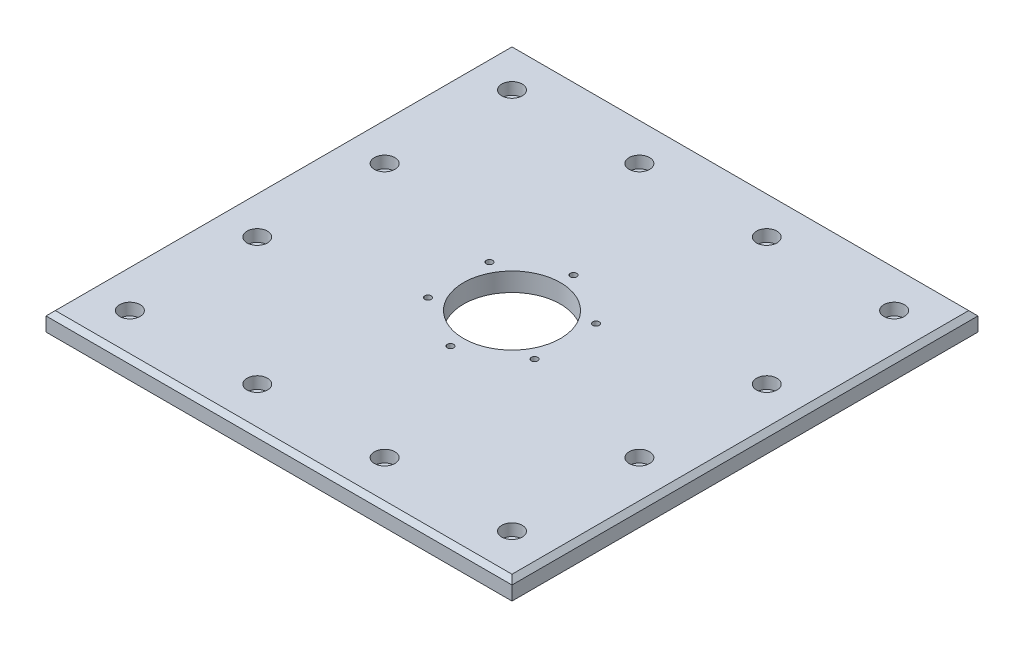
from build123d import *

# Parameters (mm, degrees)
SKETCH1_W                                           = 250
SKETCH1_H                                           = 250
SKETCH1_R                                           = 37
SKETCH1_R_2                                         = 26
BOSS_EXTRUDE1_DEPTH                                 = 10
M3_CLEARANCE_HOLE1_D                                = 3.4
CBORE_FOR_M6_HEX_SOCKET_HEAD_CAP_SCREW1_D           = 6.6
CBORE_FOR_M6_HEX_SOCKET_HEAD_CAP_SCREW1_CBORE_D     = 11
CBORE_FOR_M6_HEX_SOCKET_HEAD_CAP_SCREW1_CBORE_DEPTH = 6.4
F_2_5MM_CHAMFER1_SIZE                               = 2.5


with BuildPart() as part:
    # Sketch1 → Boss-Extrude1 (new body)
    # profile 1 of 2: a face of its own
    with BuildSketch(Plane(origin=(0, 0, 0), x_dir=(1, 0, 0), z_dir=(0, 1, 0))):
        Rectangle(SKETCH1_W, SKETCH1_H)
        Circle(SKETCH1_R, mode=Mode.SUBTRACT)
    # profile 2 of 2: a face of its own
    with BuildSketch(Plane(origin=(0, 0, 0), x_dir=(1, 0, 0), z_dir=(0, 1, 0))):
        Circle(SKETCH1_R)
        with Locations(Location((0, 0, 0), (0, 0, 270))):
            Circle(SKETCH1_R_2, mode=Mode.SUBTRACT)
    extrude(amount=BOSS_EXTRUDE1_DEPTH)

    # M3 Clearance Hole1 (through all)
    with Locations(Plane(origin=(0, 10, 0), x_dir=(1, 0, 0), z_dir=(0, 1, 0))):
        with Locations((0, 33), (28.578838325, 16.5), (28.578838325, -16.5), (0, -33), (-28.578838325, -16.5), (-28.578838325, 16.5)):
            Hole(M3_CLEARANCE_HOLE1_D / 2)

    # CBORE for M6 Hex Socket Head Cap Screw1 (through all)
    with Locations(Plane(origin=(0, 10, 0), x_dir=(1, 0, 0), z_dir=(0, 1, 0))):
        with Locations((-102.5, 102.5), (-34.16666667, 102.5), (34.16666666, 102.5), (102.5, 102.5), (102.49999999, 34.16666667), (102.49999999, -34.16666666), (102.5, -102.5), (34.16666666, -102.49999999), (-34.16666667, -102.49999999), (-102.5, -102.5), (-102.5, -34.16666666), (-102.5, 34.16666667)):
            CounterBoreHole(CBORE_FOR_M6_HEX_SOCKET_HEAD_CAP_SCREW1_D / 2, CBORE_FOR_M6_HEX_SOCKET_HEAD_CAP_SCREW1_CBORE_D / 2, CBORE_FOR_M6_HEX_SOCKET_HEAD_CAP_SCREW1_CBORE_DEPTH)

    # 2,5mm Chamfer1
    f_2_5mm_chamfer1_edges = [part.edges().sort_by_distance(p)[0] for p in [
        (125, 10, 0),
        (0, 10, -125),
        (-125, 10, 0),
        (0, 10, 125),
    ]]
    chamfer(f_2_5mm_chamfer1_edges, length=F_2_5MM_CHAMFER1_SIZE)


solid = part.part
